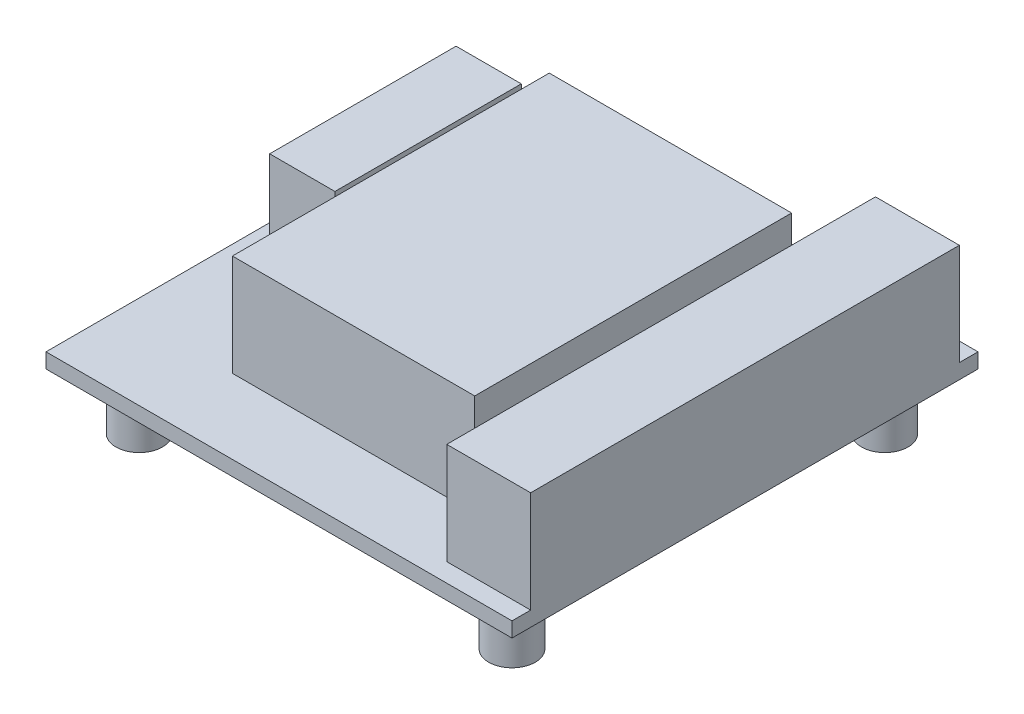
from build123d import *

# Parameters (mm, degrees)
SK_P01_STANDOFF_R                  = 2.5
P01_STANDOFF_DEPTH                 = 6
SK_P02_STANDOFF_R                  = 2.5
P02_STANDOFF_DEPTH                 = 6
SK_P03_STANDOFF_R                  = 2.5
P03_STANDOFF_DEPTH                 = 6
SK_P04_STANDOFF_R                  = 2.5
P04_STANDOFF_DEPTH                 = 6
P05_DFR0601BOARD50X50_START        = 6
SK_P05_DFR0601BOARD50X50_W         = 50
SK_P05_DFR0601BOARD50X50_H         = 50
P05_DFR0601BOARD50X50_DEPTH        = 1.6
P06_MOSFETSANDHEATSINK_START       = 7.6
SK_P06_MOSFETSANDHEATSINK_W        = 26
SK_P06_MOSFETSANDHEATSINK_H        = 34
P06_MOSFETSANDHEATSINK_DEPTH       = 10.9
P07_POWERANDMOTORTERMINALSWI_START = 7.6
SK_P07_POWERANDMOTORTERMINALSWI_W  = 9
SK_P07_POWERANDMOTORTERMINALSWI_H  = 46
P07_POWERANDMOTORTERMINALSWI_DEPTH = 10.9
P08_CONTROLHEADER_START            = 7.6
SK_P08_CONTROLHEADER_W             = 7
SK_P08_CONTROLHEADER_H             = 20
P08_CONTROLHEADER_DEPTH            = 8.4


with BuildPart() as part:
    # SK_P01_Standoff → P01_Standoff (new body)
    with BuildSketch(Plane(origin=(0, 0, 0), x_dir=(1, 0, 0), z_dir=(0, 1, 0))):
        with Locations(Location((-20, 20, 0), (0, 0, 270))):
            Circle(SK_P01_STANDOFF_R)
    extrude(amount=P01_STANDOFF_DEPTH)



with BuildPart() as body_2:
    # SK_P02_Standoff → P02_Standoff (new body)
    with BuildSketch(Plane(origin=(0, 0, 0), x_dir=(1, 0, 0), z_dir=(0, 1, 0))):
        with Locations(Location((20, 20, 0), (0, 0, 270))):
            Circle(SK_P02_STANDOFF_R)
    extrude(amount=P02_STANDOFF_DEPTH)


with BuildPart() as body_3:
    # SK_P03_Standoff → P03_Standoff (new body)
    with BuildSketch(Plane(origin=(0, 0, 0), x_dir=(1, 0, 0), z_dir=(0, 1, 0))):
        with Locations(Location((-20, -20, 0), (0, 0, 270))):
            Circle(SK_P03_STANDOFF_R)
    extrude(amount=P03_STANDOFF_DEPTH)


with BuildPart() as body_4:
    # SK_P04_Standoff → P04_Standoff (new body)
    with BuildSketch(Plane(origin=(0, 0, 0), x_dir=(1, 0, 0), z_dir=(0, 1, 0))):
        with Locations(Location((20, -20, 0), (0, 0, 270))):
            Circle(SK_P04_STANDOFF_R)
    extrude(amount=P04_STANDOFF_DEPTH)


with BuildPart() as part_1:
    add(part.part)

    add(body_2.part)  # P05_DFR0601board50x50 merges body 2

    add(body_3.part)  # P05_DFR0601board50x50 merges body 3

    add(body_4.part)  # P05_DFR0601board50x50 merges body 4
    # SK_P05_DFR0601board50x50 → P05_DFR0601board50x50 (add)
    with BuildSketch(Plane(origin=(0, 0, 0), x_dir=(1, 0, 0), z_dir=(0, 1, 0)).offset(P05_DFR0601BOARD50X50_START)):
        Rectangle(SK_P05_DFR0601BOARD50X50_W, SK_P05_DFR0601BOARD50X50_H)
    extrude(amount=P05_DFR0601BOARD50X50_DEPTH)

    # SK_P06_MOSFETsandheatsink → P06_MOSFETsandheatsink (add)
    with BuildSketch(Plane(origin=(0, 0, 0), x_dir=(1, 0, 0), z_dir=(0, 1, 0)).offset(P06_MOSFETSANDHEATSINK_START)):
        Rectangle(SK_P06_MOSFETSANDHEATSINK_W, SK_P06_MOSFETSANDHEATSINK_H)
    extrude(amount=P06_MOSFETSANDHEATSINK_DEPTH)

    # SK_P07_Powerandmotorterminalswi → P07_Powerandmotorterminalswi (add)
    with BuildSketch(Plane(origin=(0, 0, 0), x_dir=(1, 0, 0), z_dir=(0, 1, 0)).offset(P07_POWERANDMOTORTERMINALSWI_START)):
        with Locations((20.5, 0)):
            Rectangle(SK_P07_POWERANDMOTORTERMINALSWI_W, SK_P07_POWERANDMOTORTERMINALSWI_H)
    extrude(amount=P07_POWERANDMOTORTERMINALSWI_DEPTH)

    # SK_P08_Controlheader → P08_Controlheader (add)
    with BuildSketch(Plane(origin=(0, 0, 0), x_dir=(1, 0, 0), z_dir=(0, 1, 0)).offset(P08_CONTROLHEADER_START)):
        with Locations((-19.5, 7)):
            Rectangle(SK_P08_CONTROLHEADER_W, SK_P08_CONTROLHEADER_H)
    extrude(amount=P08_CONTROLHEADER_DEPTH)


solid = part_1.part
